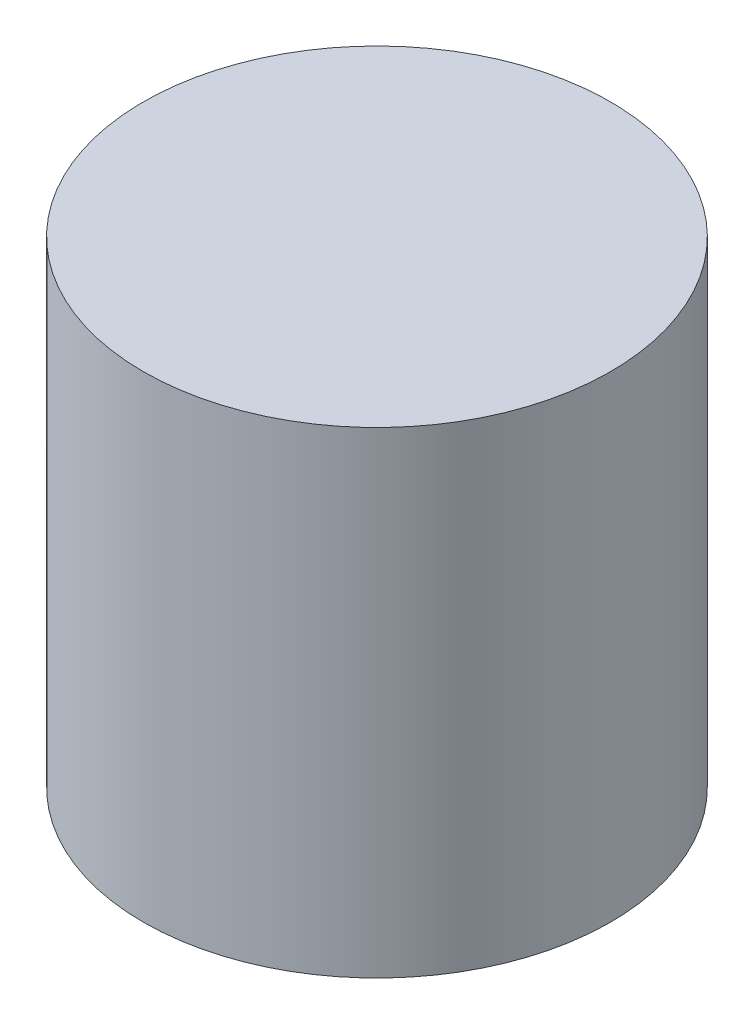
from build123d import *

# Parameters (mm, degrees)
SKETCH1_R           = 4.9
BOSS_EXTRUDE1_DEPTH = 10


with BuildPart() as part:
    # Sketch1 → Boss-Extrude1 (new body)
    with BuildSketch(Plane(origin=(0, 0, 0), x_dir=(1, 0, 0), z_dir=(0, 1, 0))):
        with Locations(Location((0, 0, 0), (0, 0, 270))):
            Circle(SKETCH1_R)
    extrude(amount=BOSS_EXTRUDE1_DEPTH)


solid = part.part
